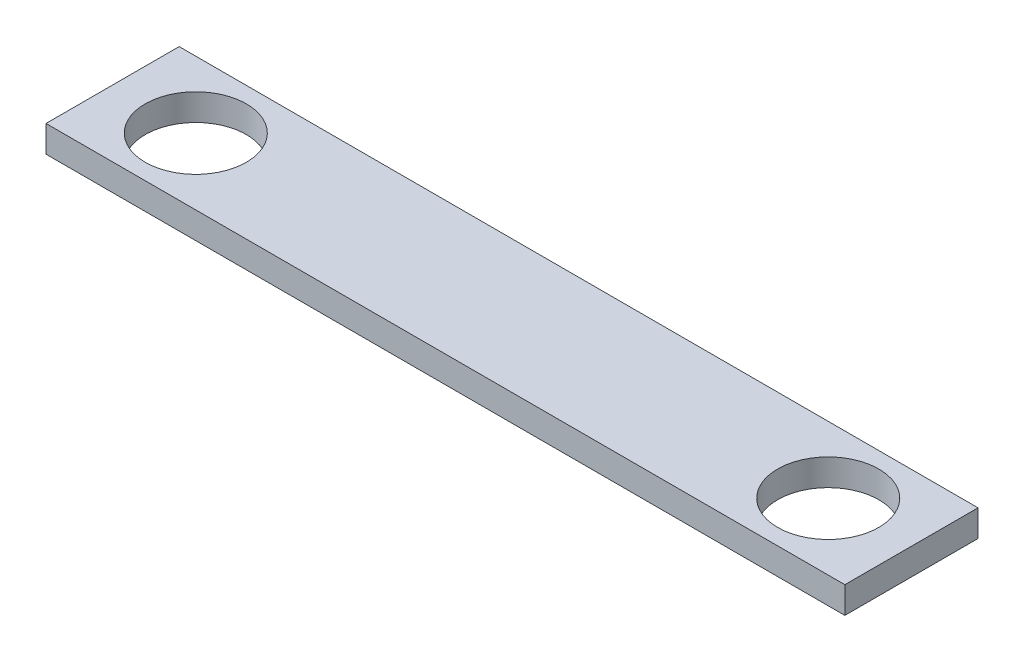
from build123d import *

# Parameters (mm, degrees)
SKETCH1_W           = 76.2
SKETCH1_H           = 12.7
SKETCH1_R           = 4.826
BOSS_EXTRUDE1_DEPTH = 2.54


with BuildPart() as part:
    # Sketch1 → Boss-Extrude1 (new body)
    with BuildSketch(Plane(origin=(0, 0, 0), x_dir=(1, 0, 0), z_dir=(0, 1, 0))):
        with Locations((38.1, 6.35)):
            Rectangle(SKETCH1_W, SKETCH1_H)
        with Locations(Location((7.9375, 6.35, 0), (0, 0, 270))):
            Circle(SKETCH1_R, mode=Mode.SUBTRACT)
        with Locations(Location((68.2625, 6.35, 0), (0, 0, 270))):
            Circle(SKETCH1_R, mode=Mode.SUBTRACT)
    extrude(amount=BOSS_EXTRUDE1_DEPTH)


solid = part.part
